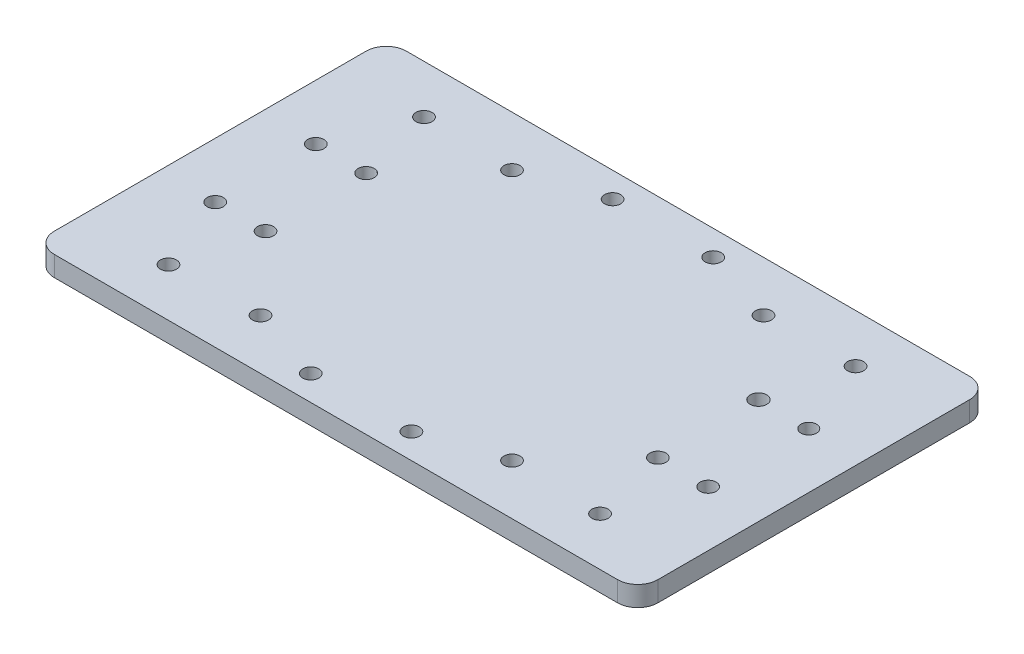
from build123d import *

# Parameters (mm, degrees)
SKETCH_1_W          = 120
SKETCH_1_H          = 70
EXTRUDE_1_DEPTH     = 4
SKETCH_2_R          = 1.6
SKETCH_2_R_2        = 1.55
SKETCH_2_R_3        = 1.65
CUT_EXTRUDE_1_DEPTH = 4
SKETCH_3_R          = 1.6
CUT_EXTRUDE_2_DEPTH = 4
FILLET_1_R          = 4


with BuildPart() as part:
    # 草图1 → 凸台-拉伸1 (new body)
    with BuildSketch(Plane(origin=(0, 0, 0), x_dir=(1, 0, 0), z_dir=(0, 1, 0))):
        with Locations((60, 35)):
            Rectangle(SKETCH_1_W, SKETCH_1_H)
    extrude(amount=EXTRUDE_1_DEPTH)

    # 草图2 → 切除-拉伸1 (cut)
    with BuildSketch(Plane(origin=(0, 4, 0), x_dir=(1, 0, 0), z_dir=(0, 1, 0))):
        with Locations(Location((11, 45, 0), (0, 0, 270))):
            Circle(SKETCH_2_R)
        with Locations(Location((21, 45, 0), (0, 0, 270))):
            Circle(SKETCH_2_R)
        with Locations(Location((21, 25, 0), (0, 0, 270))):
            Circle(SKETCH_2_R)
        with Locations(Location((11, 25, 0), (0, 0, 270))):
            Circle(SKETCH_2_R)
        with Locations(Location((109, 45, 0), (0, 0, 270))):
            Circle(SKETCH_2_R_2)
        with Locations(Location((99, 45, 0), (0, 0, 270))):
            Circle(SKETCH_2_R_3)
        with Locations(Location((109, 25, 0), (0, 0, 270))):
            Circle(SKETCH_2_R)
        with Locations(Location((99, 25, 0), (0, 0, 270))):
            Circle(SKETCH_2_R)
        with Locations(Location((102.9, 9.6, 0), (0, 0, 270))):
            Circle(SKETCH_2_R)
        with Locations(Location((17.1, 9.6, 0), (0, 0, 270))):
            Circle(SKETCH_2_R)
        with Locations(Location((17.1, 60.4, 0), (0, 0, 270))):
            Circle(SKETCH_2_R)
        with Locations(Location((102.9, 60.4, 0), (0, 0, 270))):
            Circle(SKETCH_2_R)
        with Locations(Location((85, 60, 0), (0, 0, 270))):
            Circle(SKETCH_2_R)
        with Locations(Location((85, 10, 0), (0, 0, 270))):
            Circle(SKETCH_2_R)
        with Locations(Location((35, 10, 0), (0, 0, 270))):
            Circle(SKETCH_2_R)
        with Locations(Location((35, 60, 0), (0, 0, 270))):
            Circle(SKETCH_2_R)
    extrude(amount=-CUT_EXTRUDE_1_DEPTH, mode=Mode.SUBTRACT)

    # 草图3 → 切除-拉伸2 (cut)
    with BuildSketch(Plane(origin=(0, 4, 0), x_dir=(1, 0, 0), z_dir=(0, 1, 0))):
        with Locations(Location((50, 5, 0), (0, 0, 270))):
            Circle(SKETCH_3_R)
        with Locations(Location((70, 5, 0), (0, 0, 270))):
            Circle(SKETCH_3_R)
        with Locations(Location((50, 65, 0), (0, 0, 270))):
            Circle(SKETCH_3_R)
        with Locations(Location((70, 65, 0), (0, 0, 270))):
            Circle(SKETCH_3_R)
    extrude(amount=-CUT_EXTRUDE_2_DEPTH, mode=Mode.SUBTRACT)

    # 圆角1
    fillet_1_edges = [part.edges().sort_by_distance(p)[0] for p in [
        (0, 2, -70),
        (120, 2, -70),
        (120, 2, 0),
        (0, 2, 0),
    ]]
    fillet(fillet_1_edges, radius=FILLET_1_R)


solid = part.part
